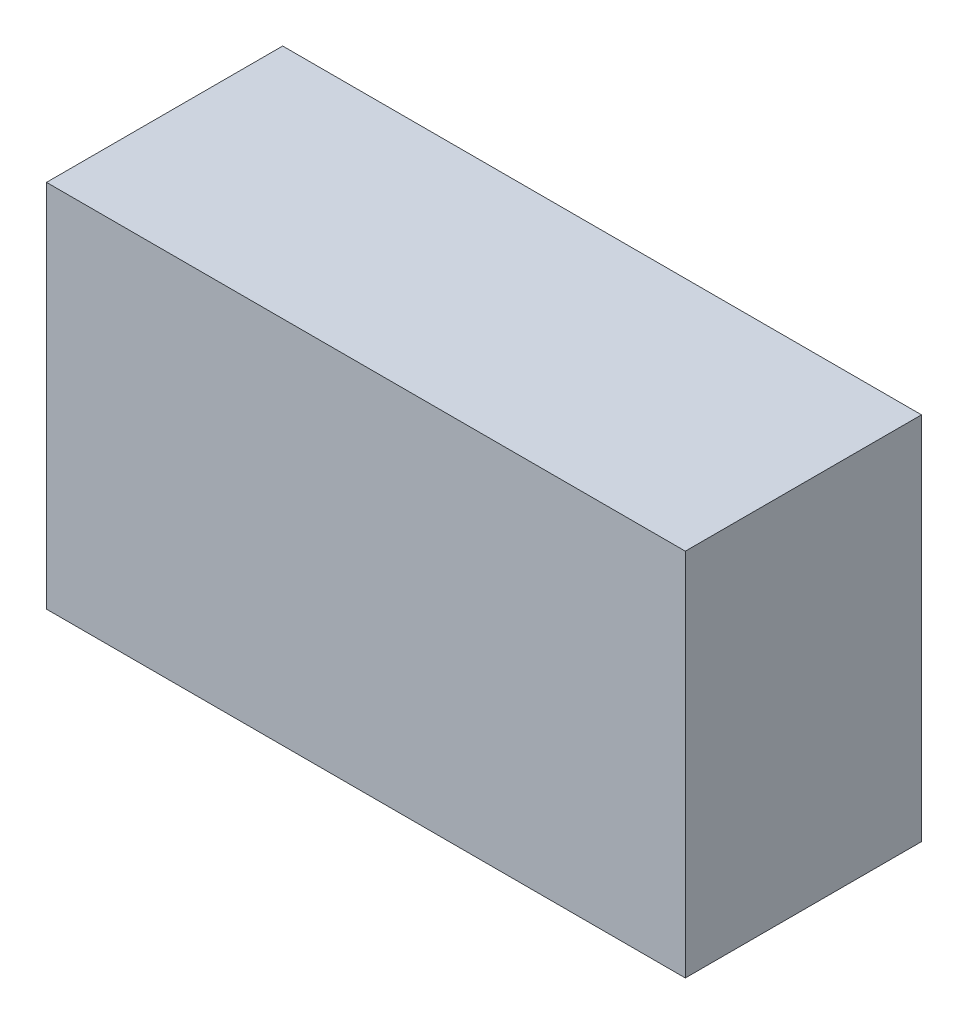
from build123d import *

# Parameters (mm, degrees)
SKETCH1_W           = 49
SKETCH1_H           = 28.353608689
BOSS_EXTRUDE1_DEPTH = 18.114


with BuildPart() as part:
    # Sketch1 → Boss-Extrude1 (new body)
    with BuildSketch(Plane.XY):
        with Locations((0, 52.28953476)):
            Rectangle(SKETCH1_W, SKETCH1_H)
    extrude(amount=BOSS_EXTRUDE1_DEPTH)


solid = part.part
